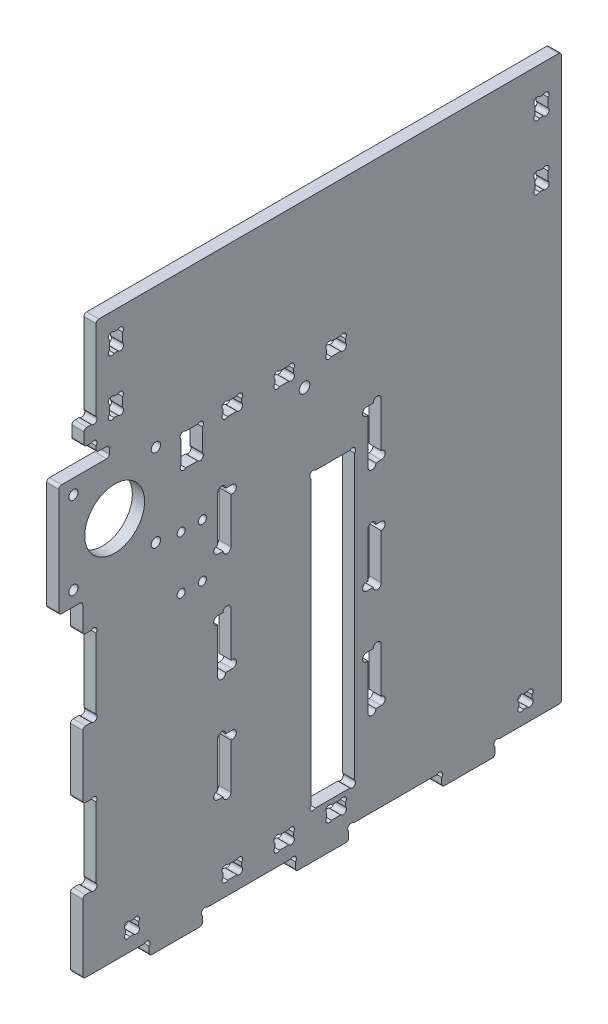
from build123d import *

# Parameters (mm, degrees)
SKETCH21_R          = 1.75
SKETCH21_R_2        = 11.25
SKETCH21_R_3        = 2
SKETCH21_W          = 7
SKETCH21_H          = 5
SKETCH21_W_2        = 5
SKETCH21_W_3        = 16.5
SKETCH21_H_2        = 110
SKETCH21_H_3        = 7
BOSS_EXTRUDE4_DEPTH = 4.6
SKETCH25_W          = 5
SKETCH25_H          = 20
CUT_EXTRUDE6_DEPTH  = 155.24383294
FILLET1_R           = 1
SKETCH27_R          = 1.25
CUT_EXTRUDE8_DEPTH  = 155.24383294
SKETCH28_W          = 8
SKETCH28_H          = 12
CUT_EXTRUDE9_DEPTH  = 155.24383294
SKETCH26_R          = 1.25
CUT_EXTRUDE7_DEPTH  = 155.24383294
SKETCH29_R          = 1.5
CUT_EXTRUDE10_DEPTH = 10


with BuildPart() as part:
    # Sketch21 → Boss-Extrude4 (new body)
    with BuildSketch(Plane(origin=(0, 0, 0), x_dir=(0, 0, -1), z_dir=(1, 0, 0))):
        Polygon((-68, 106), (107, 106), (107, -106), (82, -106), (82, -111), (62, -111), (62, -106), (27, -106), (27, -111), (7, -111), (7, -106), (-28, -106), (-28, -111), (-48, -111), (-48, -106), (-73, -106), (-73, -79), (-68, -79), (-68, -49), (-73, -49), (-73, -24), (-68, -24), (-68, 6), (-73, 6), (-73, 17), (-82, 17), (-82, 59), (-63, 59), (-63, 63), (-68, 63), (-68, 67), (-72.5, 67), (-72.5, 73), (-68, 73), align=None)
        with Locations((-45.5, 53.5)):
            Circle(SKETCH21_R, mode=Mode.SUBTRACT)
        with Locations((-61, 38)):
            Circle(SKETCH21_R_2, mode=Mode.SUBTRACT)
        with Locations((-76.5, 22.5)):
            Circle(SKETCH21_R, mode=Mode.SUBTRACT)
        with Locations((10.4, 45)):
            Circle(SKETCH21_R_3, mode=Mode.SUBTRACT)
        with Locations((-76.5, 53.5)):
            Circle(SKETCH21_R, mode=Mode.SUBTRACT)
        with Locations((-45.5, 22.5)):
            Circle(SKETCH21_R, mode=Mode.SUBTRACT)
        with Locations((-16.75, -98.5)):
            Rectangle(SKETCH21_W, SKETCH21_H, mode=Mode.SUBTRACT)
        with Locations((22.25, -98.5)):
            Rectangle(SKETCH21_W, SKETCH21_H, mode=Mode.SUBTRACT)
        with Locations((-54.5, -98.5)):
            Rectangle(SKETCH21_W_2, SKETCH21_H, mode=Mode.SUBTRACT)
        with Locations((93.5, -98.5)):
            Rectangle(SKETCH21_W_2, SKETCH21_H, mode=Mode.SUBTRACT)
        with Locations((2.75, -98.5)):
            Rectangle(SKETCH21_W, SKETCH21_H, mode=Mode.SUBTRACT)
        with Locations((21, -39)):
            Rectangle(SKETCH21_W_3, SKETCH21_H_2, mode=Mode.SUBTRACT)
        with Locations((2.75, 52.5)):
            Rectangle(SKETCH21_W, SKETCH21_H, mode=Mode.SUBTRACT)
        with Locations((-60.5, 95.5)):
            Rectangle(SKETCH21_W_2, SKETCH21_H_3, mode=Mode.SUBTRACT)
        with Locations((-16.75, 52.5)):
            Rectangle(SKETCH21_W, SKETCH21_H, mode=Mode.SUBTRACT)
        with Locations((22.25, 52.5)):
            Rectangle(SKETCH21_W, SKETCH21_H, mode=Mode.SUBTRACT)
        with Locations((99.5, 92)):
            Rectangle(SKETCH21_W_2, SKETCH21_H_3, mode=Mode.SUBTRACT)
        with Locations((99.5, 68)):
            Rectangle(SKETCH21_W_2, SKETCH21_H_3, mode=Mode.SUBTRACT)
        with Locations((-60.5, 74.5)):
            Rectangle(SKETCH21_W_2, SKETCH21_H_3, mode=Mode.SUBTRACT)
    extrude(amount=BOSS_EXTRUDE4_DEPTH)

    # Sketch25 → Cut-Extrude6 (cut, through all)
    with BuildSketch(Plane(origin=(4.6, 0, 0), x_dir=(0, 0, -1), z_dir=(1, 0, 0))):
        with Locations((36.75, 17)):
            Rectangle(SKETCH25_W, SKETCH25_H)
        with Locations((36.75, -23)):
            Rectangle(SKETCH25_W, SKETCH25_H)
        with Locations((36.75, -63)):
            Rectangle(SKETCH25_W, SKETCH25_H)
        with Locations((-19.75, 17)):
            Rectangle(SKETCH25_W, SKETCH25_H)
        with Locations((-19.75, -23)):
            Rectangle(SKETCH25_W, SKETCH25_H)
        with Locations((-19.75, -63)):
            Rectangle(SKETCH25_W, SKETCH25_H)
    extrude(amount=-CUT_EXTRUDE6_DEPTH, mode=Mode.SUBTRACT)

    # Fillet1
    fillet1_edges = [part.edges().sort_by_distance(p)[0] for p in [
        (2.3, 106, 68),
        (2.3, 106, -107),
        (2.3, -106, -107),
        (2.3, -111, -82),
        (2.3, -111, -62),
        (2.3, -111, -27),
        (2.3, -111, -7),
        (2.3, -111, 28),
        (2.3, -111, 48),
        (2.3, -106, 73),
        (2.3, -79, 73),
        (2.3, -49, 73),
        (2.3, -24, 73),
        (2.3, 6, 73),
        (2.3, 17, 73),
        (2.3, 17, 82),
        (2.3, 59, 82),
        (2.3, 59, 63),
        (2.3, 63, 63),
        (2.3, 63, 68),
        (2.3, 67, 72.5),
        (2.3, 73, 72.5),
    ]]
    fillet(fillet1_edges, radius=FILLET1_R)

    # Sketch27 → Cut-Extrude8 (cut, through all)
    with BuildSketch(Plane(origin=(4.6, 0, 0), x_dir=(0, 0, -1), z_dir=(1, 0, 0))):
        with Locations((-68.883883476, 73.883883476)):
            Circle(SKETCH27_R)
        with Locations((-68.883883476, 66.116116524)):
            Circle(SKETCH27_R)
        with Locations((-68.883883476, 5.116116524)):
            Circle(SKETCH27_R)
        with Locations((-68.883883476, -23.116116524)):
            Circle(SKETCH27_R)
        with Locations((-68.883883476, -49.883883476)):
            Circle(SKETCH27_R)
        with Locations((-68.883883476, -78.116116524)):
            Circle(SKETCH27_R)
        with Locations((-48.883883476, -106.883883476)):
            Circle(SKETCH27_R)
        with Locations((-27.116116524, -106.883883476)):
            Circle(SKETCH27_R)
        with Locations((6.116116524, -106.883883476)):
            Circle(SKETCH27_R)
        with Locations((27.883883476, -106.883883476)):
            Circle(SKETCH27_R)
        with Locations((61.116116524, -106.883883476)):
            Circle(SKETCH27_R)
        with Locations((82.883883476, -106.883883476)):
            Circle(SKETCH27_R)
    extrude(amount=-CUT_EXTRUDE8_DEPTH, mode=Mode.SUBTRACT)

    # Sketch28 → Cut-Extrude9 (cut, through all)
    with BuildSketch(Plane.ZY):
        with Locations((32, 47.151436187)):
            Rectangle(SKETCH28_W, SKETCH28_H)
    extrude(amount=-CUT_EXTRUDE9_DEPTH, mode=Mode.SUBTRACT)

    # Sketch26 → Cut-Extrude7 (cut, through all)
    with BuildSketch(Plane(origin=(4.6, 0, 0), x_dir=(0, 0, -1), z_dir=(1, 0, 0))):
        with Locations((97.883883476, 94.616116524)):
            Circle(SKETCH26_R)
        with Locations((101.116116524, 94.616116524)):
            Circle(SKETCH26_R)
        with Locations((101.116116524, 89.383883476)):
            Circle(SKETCH26_R)
        with Locations((97.883883476, 89.383883476)):
            Circle(SKETCH26_R)
        with Locations((95.116116524, -96.883883476)):
            Circle(SKETCH26_R)
        with Locations((95.116116524, -100.116116524)):
            Circle(SKETCH26_R)
        with Locations((24.866116524, -100.116116524)):
            Circle(SKETCH26_R)
        with Locations((24.866116524, -96.883883476)):
            Circle(SKETCH26_R)
        with Locations((5.366116524, -100.116116524)):
            Circle(SKETCH26_R)
        with Locations((5.366116524, -96.883883476)):
            Circle(SKETCH26_R)
        with Locations((-14.133883476, -100.116116524)):
            Circle(SKETCH26_R)
        with Locations((-14.133883476, -96.883883476)):
            Circle(SKETCH26_R)
        with Locations((-56.116116524, -96.883883476)):
            Circle(SKETCH26_R)
        with Locations((-52.883883476, -96.883883476)):
            Circle(SKETCH26_R)
        with Locations((-19.366116524, 54.116116524)):
            Circle(SKETCH26_R)
        with Locations((-19.366116524, 50.883883476)):
            Circle(SKETCH26_R)
        with Locations((0.133883476, 54.116116524)):
            Circle(SKETCH26_R)
        with Locations((0.133883476, 50.883883476)):
            Circle(SKETCH26_R)
        with Locations((19.633883476, 54.116116524)):
            Circle(SKETCH26_R)
        with Locations((19.633883476, 50.883883476)):
            Circle(SKETCH26_R)
        with Locations((97.883883476, 65.383883476)):
            Circle(SKETCH26_R)
        with Locations((101.116116524, 65.383883476)):
            Circle(SKETCH26_R)
        with Locations((101.116116524, 70.616116524)):
            Circle(SKETCH26_R)
        with Locations((97.883883476, 70.616116524)):
            Circle(SKETCH26_R)
        with Locations((91.883883476, -96.883883476)):
            Circle(SKETCH26_R)
        with Locations((91.883883476, -100.116116524)):
            Circle(SKETCH26_R)
        with Locations((19.633883476, -96.883883476)):
            Circle(SKETCH26_R)
        with Locations((19.633883476, -100.116116524)):
            Circle(SKETCH26_R)
        with Locations((0.133883476, -96.883883476)):
            Circle(SKETCH26_R)
        with Locations((0.133883476, -100.116116524)):
            Circle(SKETCH26_R)
        with Locations((-19.366116524, -96.883883476)):
            Circle(SKETCH26_R)
        with Locations((-19.366116524, -100.116116524)):
            Circle(SKETCH26_R)
        with Locations((-56.116116524, -100.116116524)):
            Circle(SKETCH26_R)
        with Locations((-52.883883476, -100.116116524)):
            Circle(SKETCH26_R)
        with Locations((-14.133883476, 50.883883476)):
            Circle(SKETCH26_R)
        with Locations((-14.133883476, 54.116116524)):
            Circle(SKETCH26_R)
        with Locations((5.366116524, 50.883883476)):
            Circle(SKETCH26_R)
        with Locations((5.366116524, 54.116116524)):
            Circle(SKETCH26_R)
        with Locations((24.866116524, 50.883883476)):
            Circle(SKETCH26_R)
        with Locations((24.866116524, 54.116116524)):
            Circle(SKETCH26_R)
        with Locations((13.633883476, 15.116116524)):
            Circle(SKETCH26_R)
        with Locations((28.366116524, 15.116116524)):
            Circle(SKETCH26_R)
        with Locations((28.366116524, -93.116116524)):
            Circle(SKETCH26_R)
        with Locations((13.633883476, -93.116116524)):
            Circle(SKETCH26_R)
        with Locations((-62.116116524, 98.116116524)):
            Circle(SKETCH26_R)
        with Locations((-58.883883476, 98.116116524)):
            Circle(SKETCH26_R)
        with Locations((-101.633883476, 54.116116524)):
            Circle(SKETCH26_R)
        with Locations((-58.883883476, 92.883883476)):
            Circle(SKETCH26_R)
        with Locations((-62.116116524, 92.883883476)):
            Circle(SKETCH26_R)
        with Locations((-58.883883476, 71.883883476)):
            Circle(SKETCH26_R)
        with Locations((-62.116116524, 71.883883476)):
            Circle(SKETCH26_R)
        with Locations((-62.116116524, 77.116116524)):
            Circle(SKETCH26_R)
        with Locations((-58.883883476, 77.116116524)):
            Circle(SKETCH26_R)
        with Locations((-35.12, 52.263686222)):
            Circle(SKETCH26_R)
        with Locations((-35.12, 42.039186152)):
            Circle(SKETCH26_R)
        with Locations((-28.88, 42.039186152)):
            Circle(SKETCH26_R)
        with Locations((-28.88, 52.263686222)):
            Circle(SKETCH26_R)
        with BuildLine():
            Line((39.25, -73), (38.75, -73))
            ThreePointArc((38.75, -73), (37.25, -71.5), (38.75, -70))
            Line((38.75, -70), (39.25, -70))
            ThreePointArc((39.25, -70), (40.75, -71.5), (39.25, -73))
        make_face()
        with BuildLine():
            Line((33.75, -53), (34.25, -53))
            ThreePointArc((34.25, -53), (35.75, -54.5), (34.25, -56))
            Line((34.25, -56), (33.75, -56))
            ThreePointArc((33.75, -56), (32.25, -54.5), (33.75, -53))
        make_face()
        with BuildLine():
            Line((39.25, -53), (39.25, -53.5))
            ThreePointArc((39.25, -53.5), (37.75, -55), (36.25, -53.5))
            Line((36.25, -53.5), (36.25, -53))
            ThreePointArc((36.25, -53), (37.75, -51.5), (39.25, -53))
        make_face()
        with BuildLine():
            Line((37.25, -72.5), (37.25, -73))
            ThreePointArc((37.25, -73), (35.75, -74.5), (34.25, -73))
            Line((34.25, -73), (34.25, -72.5))
            ThreePointArc((34.25, -72.5), (35.75, -71), (37.25, -72.5))
        make_face()
        with BuildLine():
            Line((39.25, -13), (38.75, -13))
            ThreePointArc((38.75, -13), (37.25, -14.5), (38.75, -16))
            Line((38.75, -16), (39.25, -16))
            ThreePointArc((39.25, -16), (40.75, -14.5), (39.25, -13))
        make_face()
        with BuildLine():
            Line((33.75, -33), (34.25, -33))
            ThreePointArc((34.25, -33), (35.75, -31.5), (34.25, -30))
            Line((34.25, -30), (33.75, -30))
            ThreePointArc((33.75, -30), (32.25, -31.5), (33.75, -33))
        make_face()
        with BuildLine():
            Line((39.25, -33), (39.25, -32.5))
            ThreePointArc((39.25, -32.5), (37.75, -31), (36.25, -32.5))
            Line((36.25, -32.5), (36.25, -33))
            ThreePointArc((36.25, -33), (37.75, -34.5), (39.25, -33))
        make_face()
        with BuildLine():
            Line((37.25, -13.5), (37.25, -13))
            ThreePointArc((37.25, -13), (35.75, -11.5), (34.25, -13))
            Line((34.25, -13), (34.25, -13.5))
            ThreePointArc((34.25, -13.5), (35.75, -15), (37.25, -13.5))
        make_face()
        with BuildLine():
            Line((39.25, 7), (38.75, 7))
            ThreePointArc((38.75, 7), (37.25, 8.5), (38.75, 10))
            Line((38.75, 10), (39.25, 10))
            ThreePointArc((39.25, 10), (40.75, 8.5), (39.25, 7))
        make_face()
        with BuildLine():
            Line((33.75, 27), (34.25, 27))
            ThreePointArc((34.25, 27), (35.75, 25.5), (34.25, 24))
            Line((34.25, 24), (33.75, 24))
            ThreePointArc((33.75, 24), (32.25, 25.5), (33.75, 27))
        make_face()
        with BuildLine():
            Line((39.25, 27), (39.25, 26.5))
            ThreePointArc((39.25, 26.5), (37.75, 25), (36.25, 26.5))
            Line((36.25, 26.5), (36.25, 27))
            ThreePointArc((36.25, 27), (37.75, 28.5), (39.25, 27))
        make_face()
        with BuildLine():
            Line((37.25, 7.5), (37.25, 7))
            ThreePointArc((37.25, 7), (35.75, 5.5), (34.25, 7))
            Line((34.25, 7), (34.25, 7.5))
            ThreePointArc((34.25, 7.5), (35.75, 9), (37.25, 7.5))
        make_face()
        with BuildLine():
            Line((-22.25, -73), (-21.75, -73))
            ThreePointArc((-21.75, -73), (-20.25, -71.5), (-21.75, -70))
            Line((-21.75, -70), (-22.25, -70))
            ThreePointArc((-22.25, -70), (-23.75, -71.5), (-22.25, -73))
        make_face()
        with BuildLine():
            Line((-16.75, -53), (-17.25, -53))
            ThreePointArc((-17.25, -53), (-18.75, -54.5), (-17.25, -56))
            Line((-17.25, -56), (-16.75, -56))
            ThreePointArc((-16.75, -56), (-15.25, -54.5), (-16.75, -53))
        make_face()
        with BuildLine():
            Line((-22.25, -53), (-22.25, -53.5))
            ThreePointArc((-22.25, -53.5), (-20.75, -55), (-19.25, -53.5))
            Line((-19.25, -53.5), (-19.25, -53))
            ThreePointArc((-19.25, -53), (-20.75, -51.5), (-22.25, -53))
        make_face()
        with BuildLine():
            Line((-20.25, -72.5), (-20.25, -73))
            ThreePointArc((-20.25, -73), (-18.75, -74.5), (-17.25, -73))
            Line((-17.25, -73), (-17.25, -72.5))
            ThreePointArc((-17.25, -72.5), (-18.75, -71), (-20.25, -72.5))
        make_face()
        with BuildLine():
            Line((-22.25, -13), (-21.75, -13))
            ThreePointArc((-21.75, -13), (-20.25, -14.5), (-21.75, -16))
            Line((-21.75, -16), (-22.25, -16))
            ThreePointArc((-22.25, -16), (-23.75, -14.5), (-22.25, -13))
        make_face()
        with BuildLine():
            Line((-16.75, -33), (-17.25, -33))
            ThreePointArc((-17.25, -33), (-18.75, -31.5), (-17.25, -30))
            Line((-17.25, -30), (-16.75, -30))
            ThreePointArc((-16.75, -30), (-15.25, -31.5), (-16.75, -33))
        make_face()
        with BuildLine():
            Line((-22.25, -33), (-22.25, -32.5))
            ThreePointArc((-22.25, -32.5), (-20.75, -31), (-19.25, -32.5))
            Line((-19.25, -32.5), (-19.25, -33))
            ThreePointArc((-19.25, -33), (-20.75, -34.5), (-22.25, -33))
        make_face()
        with BuildLine():
            Line((-20.25, -13.5), (-20.25, -13))
            ThreePointArc((-20.25, -13), (-18.75, -11.5), (-17.25, -13))
            Line((-17.25, -13), (-17.25, -13.5))
            ThreePointArc((-17.25, -13.5), (-18.75, -15), (-20.25, -13.5))
        make_face()
        with BuildLine():
            Line((-22.25, 7), (-21.75, 7))
            ThreePointArc((-21.75, 7), (-20.25, 8.5), (-21.75, 10))
            Line((-21.75, 10), (-22.25, 10))
            ThreePointArc((-22.25, 10), (-23.75, 8.5), (-22.25, 7))
        make_face()
        with BuildLine():
            Line((-16.75, 27), (-17.25, 27))
            ThreePointArc((-17.25, 27), (-18.75, 25.5), (-17.25, 24))
            Line((-17.25, 24), (-16.75, 24))
            ThreePointArc((-16.75, 24), (-15.25, 25.5), (-16.75, 27))
        make_face()
        with BuildLine():
            Line((-22.25, 27), (-22.25, 26.5))
            ThreePointArc((-22.25, 26.5), (-20.75, 25), (-19.25, 26.5))
            Line((-19.25, 26.5), (-19.25, 27))
            ThreePointArc((-19.25, 27), (-20.75, 28.5), (-22.25, 27))
        make_face()
        with BuildLine():
            Line((-20.25, 7.5), (-20.25, 7))
            ThreePointArc((-20.25, 7), (-18.75, 5.5), (-17.25, 7))
            Line((-17.25, 7), (-17.25, 7.5))
            ThreePointArc((-17.25, 7.5), (-18.75, 9), (-20.25, 7.5))
        make_face()
    extrude(amount=-CUT_EXTRUDE7_DEPTH, mode=Mode.SUBTRACT)

    # Sketch29 → Cut-Extrude10 (cut)
    with BuildSketch(Plane.ZY):
        with Locations((28, 21.151436187)):
            Circle(SKETCH29_R)
        with Locations((36, 21.151436187)):
            Circle(SKETCH29_R)
        with Locations((36, 1.151436187)):
            Circle(SKETCH29_R)
        with Locations((28, 1.151436187)):
            Circle(SKETCH29_R)
    extrude(amount=-CUT_EXTRUDE10_DEPTH, mode=Mode.SUBTRACT)


solid = part.part
